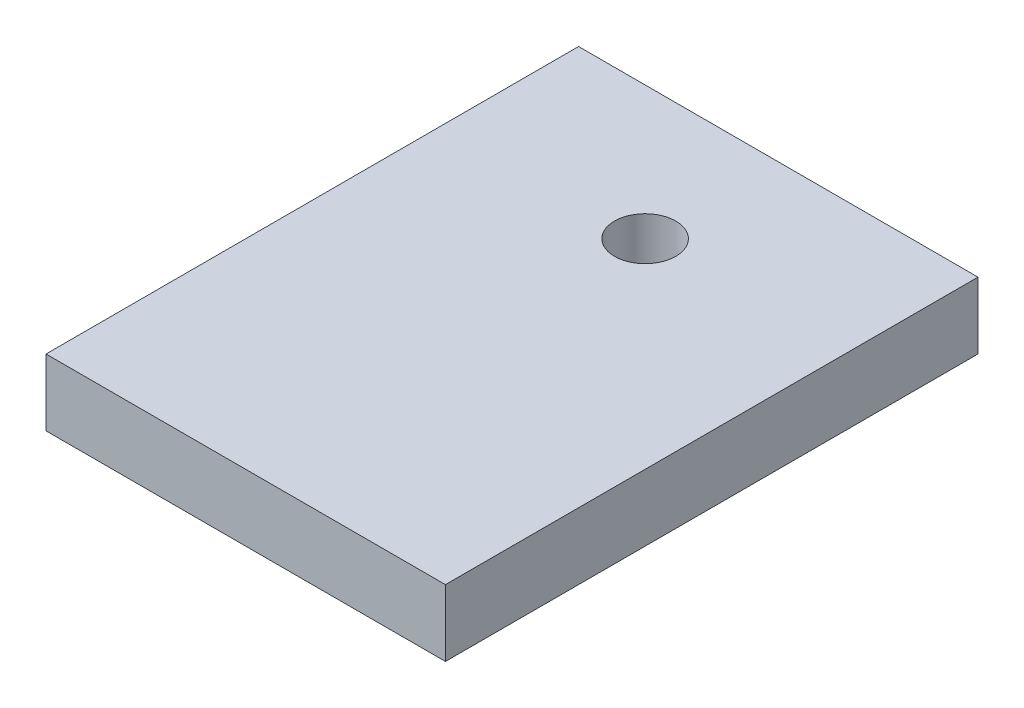
from build123d import *

# Parameters (mm, degrees)
SKETCH1_W           = 19.05
SKETCH1_H           = 25.4
SKETCH1_R           = 1.4605
BOSS_EXTRUDE1_DEPTH = 3.175


with BuildPart() as part:
    # Sketch1 → Boss-Extrude1 (new body)
    with BuildSketch(Plane(origin=(0, 0, 0), x_dir=(1, 0, 0), z_dir=(0, 1, 0))):
        with Locations((9.525, 12.7)):
            Rectangle(SKETCH1_W, SKETCH1_H)
        with Locations(Location((9.525, 19.05, 0), (0, 0, 270))):
            Circle(SKETCH1_R, mode=Mode.SUBTRACT)
    extrude(amount=BOSS_EXTRUDE1_DEPTH)


solid = part.part
